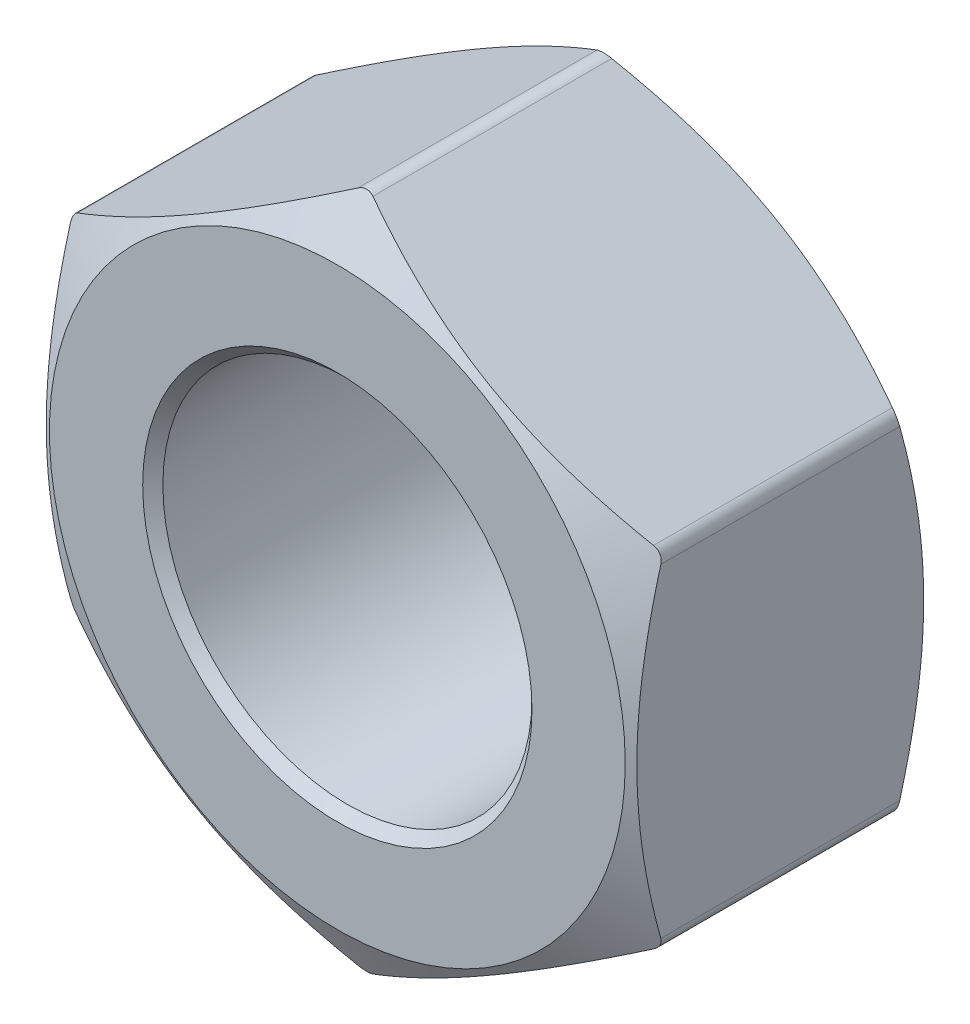
from build123d import *

# Parameters (mm, degrees)
BOSS_EXTRUDE1_DEPTH      = 2
BOSS_EXTRUDE1_DEPTH_BACK = 2
SKETCH2_R                = 2.5
SKETCH3_OUTSIDE_W        = 41.334
SKETCH3_OUTSIDE_H        = 42.572
SKETCH3_OUTSIDE_R        = 3.9
CUT_EXTRUDE1_DEPTH       = 8.302967433
CUT_EXTRUDE1_DRAFT       = -60
FILLET1_R                = 0.2
MIRROR1_COPY_1_SKETCH_W  = 41.334
MIRROR1_COPY_1_SKETCH_H  = 42.572
MIRROR1_COPY_1_SKETCH_R  = 3.9
MIRROR1_COPY_1_DEPTH     = 8.302967433
MIRROR1_COPY_1_DRAFT     = -60


with BuildPart() as part:
    # Sketch2 → Boss-Extrude1 (new, two sides: drawn at the far end of the back side and taken through both)
    with BuildSketch(Plane.XY.offset(-BOSS_EXTRUDE1_DEPTH_BACK)):
        Polygon((0, 4.618802154), (-4, 2.309401077), (-4, -2.309401077), (0, -4.618802154), (4, -2.309401077), (4, 2.309401077), align=None)
        Circle(SKETCH2_R, mode=Mode.SUBTRACT)
    extrude(amount=BOSS_EXTRUDE1_DEPTH + BOSS_EXTRUDE1_DEPTH_BACK)


with BuildPart() as cut_extrude1_tool:
    # Sketch3 outside → Cut-Extrude1 (with draft: the straight prism first)
    with BuildSketch(Plane.XY.offset(2)):
        Rectangle(SKETCH3_OUTSIDE_W, SKETCH3_OUTSIDE_H)
        Circle(SKETCH3_OUTSIDE_R, mode=Mode.SUBTRACT)
    extrude(amount=-CUT_EXTRUDE1_DEPTH)
    # Cut-Extrude1: the draft: its side faces are tilted about the plane it starts from
    cut_extrude1_sides = [cut_extrude1_tool.faces().sort_by_distance(p)[0] for p in [
        (0, -21.286, -2.151483717),
        (20.667, 0, -2.151483717),
        (0, 21.286, -2.151483717),
        (-20.667, 0, -2.151483717),
        (-3.9, 0, -2.151483717),
    ]]
    draft(cut_extrude1_sides, Plane.XY.offset(2), CUT_EXTRUDE1_DRAFT)


with BuildPart() as part_1:
    add(part.part)

    # Cut-Extrude1: cut by cut_extrude1_tool
    add(cut_extrude1_tool.part, mode=Mode.SUBTRACT)

    # Fillet1
    fillet1_edges = [part_1.edges().sort_by_distance(p)[0] for p in [
        (4, -2.309401077, -0.207500308),
        (0, -4.618802154, -0.207500308),
        (-4, -2.309401077, -0.207500308),
        (-4, 2.309401077, -0.207500308),
        (4, 2.309401077, -0.207500308),
        (0, 4.618802154, -0.207500308),
    ]]
    fillet(fillet1_edges, radius=FILLET1_R)

    # Cut-Extrude4 cone 1 section (through the dimple's axis) → Cut-Extrude4 (revolve, cut)
    with BuildSketch(Plane(origin=(0, 0, 2), x_dir=(0, -1, 0), z_dir=(1, 0, 0))):
        Polygon((0, 0), (2.63660254, 0), (0, 2.63660254), align=None)
    cut_extrude4 = revolve(axis=Axis((0, 0, 2), (0, 0, -1)), mode=Mode.SUBTRACT)

    # Mirror1: Cut-Extrude4 across plane
    add(cut_extrude4.mirror(Plane.XY), mode=Mode.SUBTRACT)


with BuildPart() as mirror1_copy_1_tool:
    # Mirror1 copy 1 sketch → Mirror1 copy 1 (with draft: the straight prism first)
    with BuildSketch(Plane(origin=(0, 0, -2), x_dir=(1, 0, 0), z_dir=(0, 0, -1))):
        Rectangle(MIRROR1_COPY_1_SKETCH_W, MIRROR1_COPY_1_SKETCH_H)
        Circle(MIRROR1_COPY_1_SKETCH_R, mode=Mode.SUBTRACT)
    extrude(amount=-MIRROR1_COPY_1_DEPTH)
    # Mirror1 copy 1: the draft: its side faces are tilted about the plane it starts from
    mirror1_copy_1_sides = [mirror1_copy_1_tool.faces().sort_by_distance(p)[0] for p in [
        (0, -21.286, 2.151483717),
        (20.667, 0, 2.151483717),
        (0, 21.286, 2.151483717),
        (-20.667, 0, 2.151483717),
        (-3.9, 0, 2.151483717),
    ]]
    draft(mirror1_copy_1_sides, Plane(origin=(0, 0, -2), x_dir=(1, 0, 0), z_dir=(0, 0, -1)), MIRROR1_COPY_1_DRAFT)


with BuildPart() as part_2:
    add(part_1.part)

    # Mirror1 copy 1: cut by mirror1_copy_1_tool
    add(mirror1_copy_1_tool.part, mode=Mode.SUBTRACT)


solid = part_2.part
